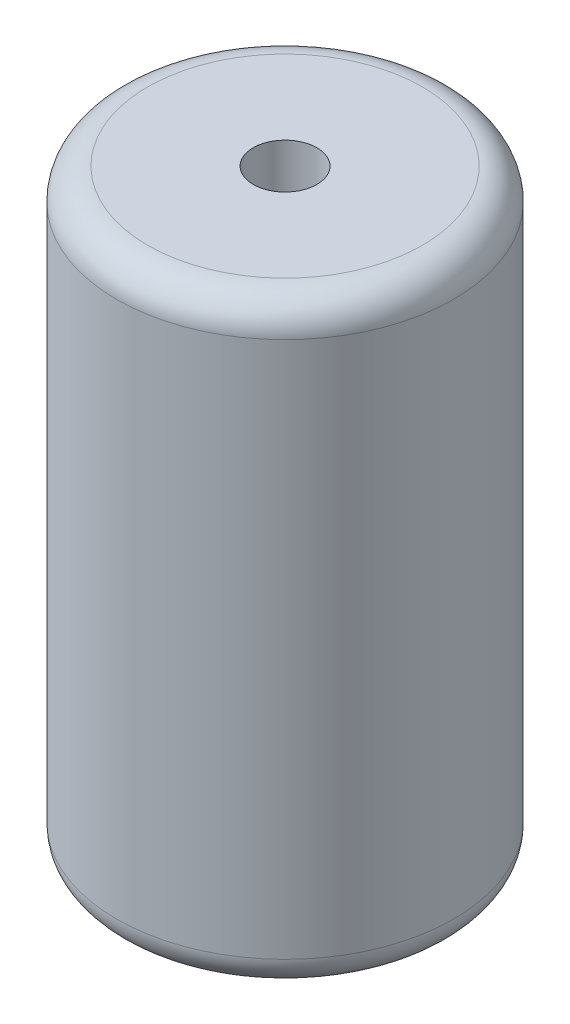
from build123d import *

# Parameters (mm, degrees)
CROQUIS1_R              = 27
CROQUIS1_R_2            = 5.1
SALIENTE_EXTRUIR1_DEPTH = 96
REDONDEO1_R             = 5


with BuildPart() as part:
    # Croquis1 → Saliente-Extruir1 (new body)
    with BuildSketch(Plane(origin=(0, 0, 0), x_dir=(1, 0, 0), z_dir=(0, 1, 0))):
        with Locations(Location((0, 0, 0), (0, 0, 270))):
            Circle(CROQUIS1_R)
        with Locations(Location((0, 0, 0), (0, 0, 270))):
            Circle(CROQUIS1_R_2, mode=Mode.SUBTRACT)
    extrude(amount=SALIENTE_EXTRUIR1_DEPTH)

    # Redondeo1
    redondeo1_edges = [part.edges().sort_by_distance(p)[0] for p in [
        (0, 0, -27),
        (0, 96, -27),
    ]]
    fillet(redondeo1_edges, radius=REDONDEO1_R)


solid = part.part
